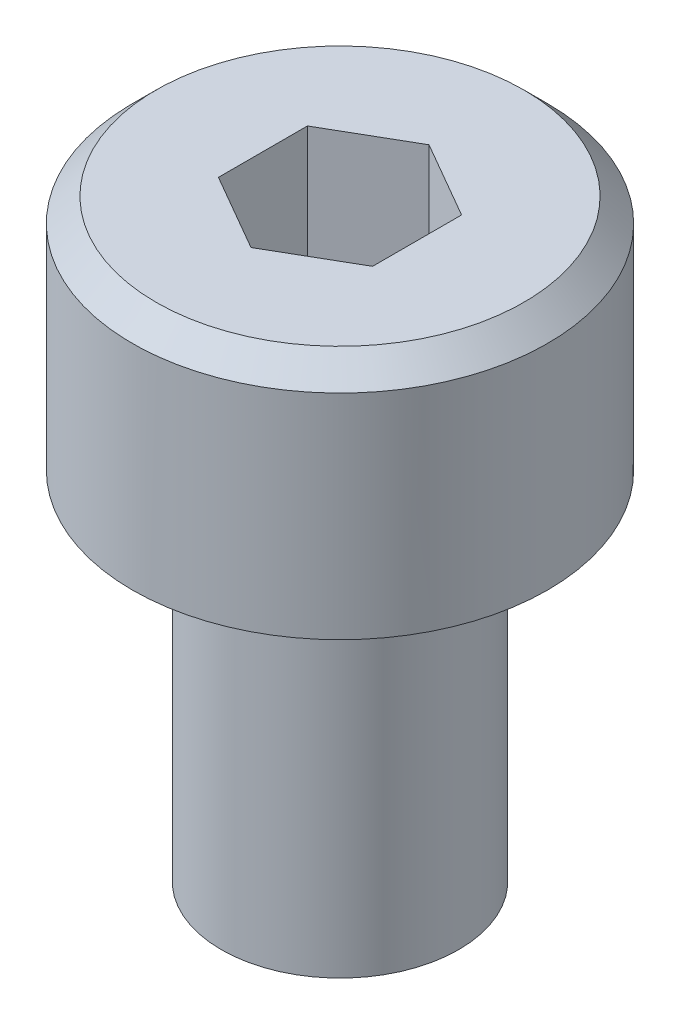
from build123d import *

# Parameters (mm, degrees)
CROQUIS4_R              = 3.5
SALIENTE_EXTRUIR3_DEPTH = 4
CHAFL_N2_SIZE           = 0.4
CROQUIS6_3_R            = 2
SALIENTE_EXTRUIR5_DEPTH = 6


with BuildPart() as part:
    # Croquis4 → Saliente-Extruir3 (new body)
    with BuildSketch(Plane(origin=(0, 0, 0), x_dir=(1, 0, 0), z_dir=(0, 1, 0))):
        Circle(CROQUIS4_R)
        Polygon((0, 1.5), (-1.299038106, 0.75), (-1.299038106, -0.75), (0, -1.5), (1.299038106, -0.75), (1.299038106, 0.75), align=None, mode=Mode.SUBTRACT)
    extrude(amount=SALIENTE_EXTRUIR3_DEPTH)

    # Chaflán2
    chafl_n2_edges = [part.edges().sort_by_distance(p)[0] for p in [
        (-3.5, 4, 0),
    ]]
    chamfer(chafl_n2_edges, length=CHAFL_N2_SIZE)

    # Croquis5 → Revolución2 (revolve)
    with BuildSketch(Plane.XY):
        Polygon((0, 0), (0, 1.133974596), (1.5, 2), (3.5, 2), (3.5, 0), align=None)
    revolve(axis=Axis((0, 0, 0), (0, 1, 0)))

    # Croquis6<3> → Saliente-Extruir5 (add)
    with BuildSketch(Plane.XZ):
        Circle(CROQUIS6_3_R)
    extrude(amount=SALIENTE_EXTRUIR5_DEPTH)


solid = part.part
